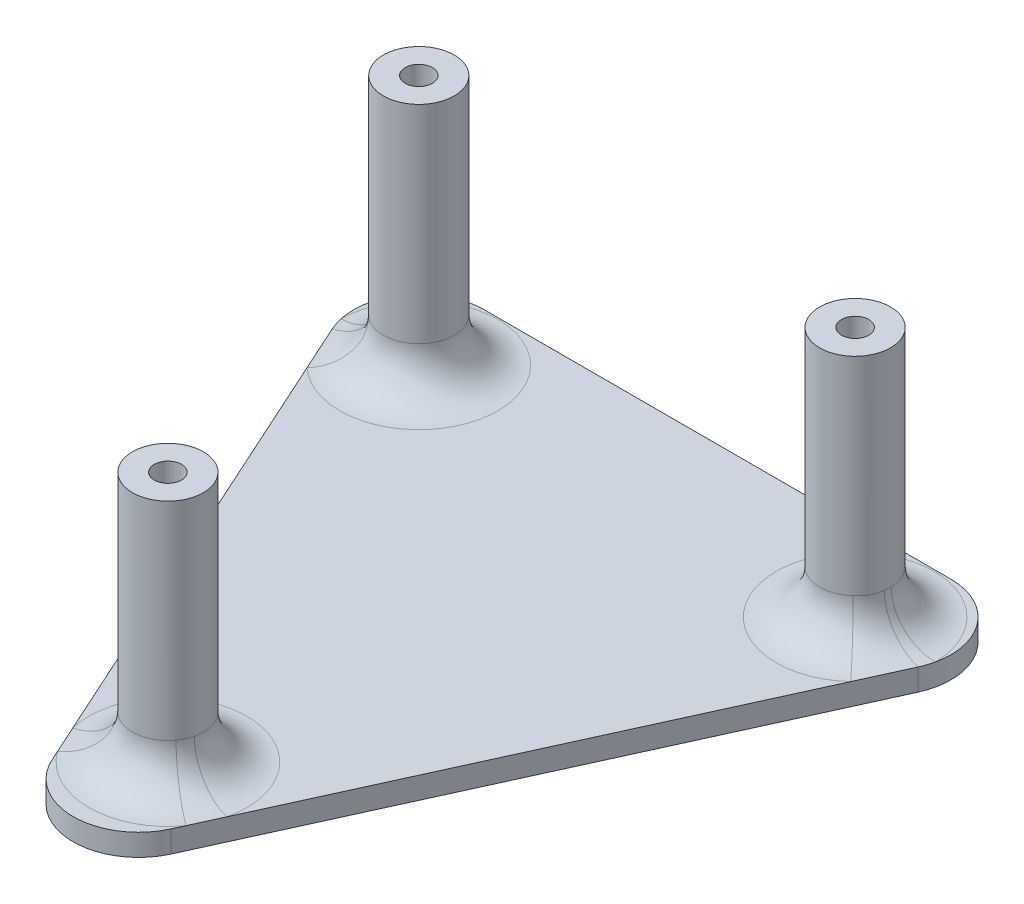
from build123d import *

# Parameters (mm, degrees)
BOSS_EXTRUDE1_DEPTH = 2
SKETCH1_3_R         = 3.25
SKETCH1_3_R_2       = 1.25
BOSS_EXTRUDE2_DEPTH = 23
FILLET1_R           = 4


with BuildPart() as part:
    # Sketch1 → Boss-Extrude1 (new body)
    with BuildSketch(Plane(origin=(0, 0, 0), x_dir=(1, 0, 0), z_dir=(0, 1, 0))):
        with BuildLine():
            Line((-28.08102558, 42.716483516), (-70.851819352, 42.716483516))
            ThreePointArc((-70.851819352, 42.716483516), (-75.89592212, 39.96564145), (-76.314848193, 34.235492608))
            Line((-76.314848193, 34.235492608), (-54.929451307, -12.854176105))
            ThreePointArc((-54.929451307, -12.854176105), (-49.466422466, -16.373185197), (-44.003393626, -12.854176105))
            Line((-44.003393626, -12.854176105), (-22.61799674, 34.235492608))
            ThreePointArc((-22.61799674, 34.235492608), (-23.036922813, 39.96564145), (-28.08102558, 42.716483516))
        make_face()
    extrude(amount=-BOSS_EXTRUDE1_DEPTH)

    # Sketch1<3> → Boss-Extrude2 (add)
    # profile 1 of 3: a face of its own
    with BuildSketch(Plane(origin=(0, 0, 0), x_dir=(1, 0, 0), z_dir=(0, 1, 0))):
        with Locations((-49.466422466, -7.683516484)):
            Circle(SKETCH1_3_R)
        with Locations((-49.466422466, -7.683516484)):
            Circle(SKETCH1_3_R_2, mode=Mode.SUBTRACT)
    # profile 2 of 3: a face of its own
    with BuildSketch(Plane(origin=(0, 0, 0), x_dir=(1, 0, 0), z_dir=(0, 1, 0))):
        with Locations((-29.466422466, 35.316483516)):
            Circle(SKETCH1_3_R)
        with Locations((-29.466422466, 35.316483516)):
            Circle(SKETCH1_3_R_2, mode=Mode.SUBTRACT)
    # profile 3 of 3: a face of its own
    with BuildSketch(Plane(origin=(0, 0, 0), x_dir=(1, 0, 0), z_dir=(0, 1, 0))):
        with Locations((-69.466422466, 35.316483516)):
            Circle(SKETCH1_3_R)
        with Locations((-69.466422466, 35.316483516)):
            Circle(SKETCH1_3_R_2, mode=Mode.SUBTRACT)
    extrude(amount=BOSS_EXTRUDE2_DEPTH)

    # Fillet1
    fillet1_edges = [part.edges().sort_by_distance(p)[0] for p in [
        (-52.716422466, 0, 7.683516484),
        (-72.716422466, 0, -35.316483516),
        (-32.716422466, 0, -35.316483516),
    ]]
    fillet(fillet1_edges, radius=FILLET1_R)


solid = part.part
